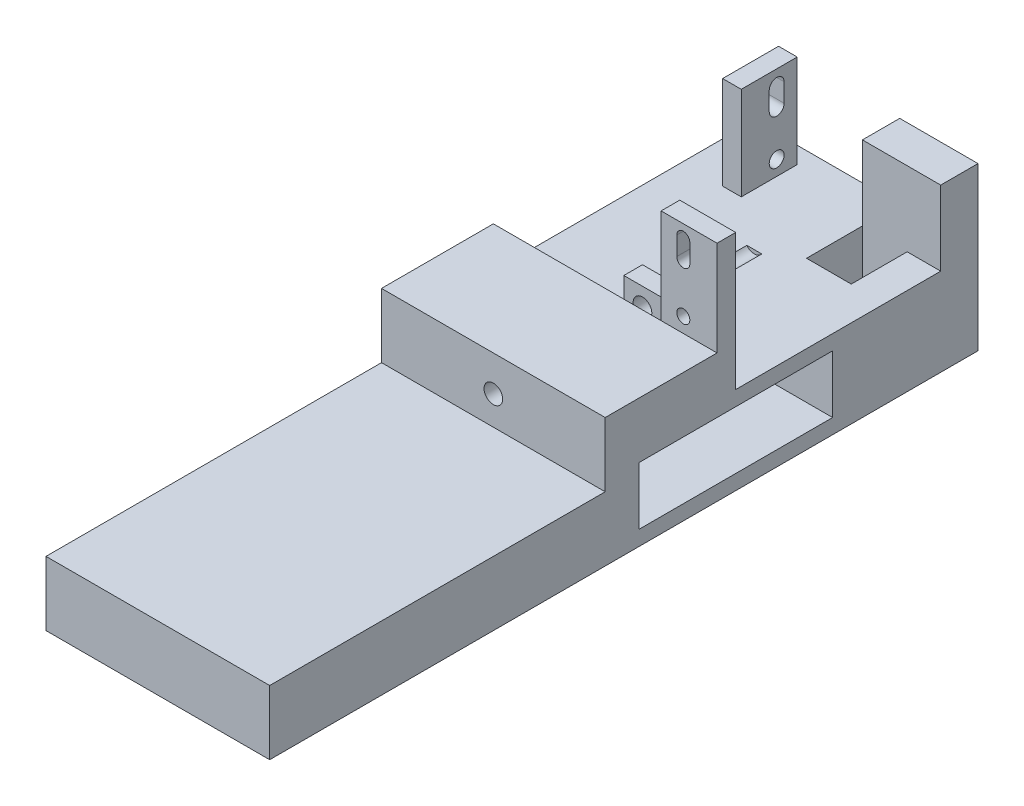
from build123d import *

# Parameters (mm, degrees)
SKETCH1_W               = 60
SKETCH1_H               = 70
BOSS_EXTRUDE1_DEPTH     = 23.5
SHELL1_T                = -9
SKETCH2_W               = 10
SKETCH2_H               = 5
BOSS_EXTRUDE2_DEPTH     = 6.5
SKETCH5_W               = 60
SKETCH5_H               = 30
BOSS_EXTRUDE3_DEPTH     = 11
CUT_EXTRUDE1_DEPTH      = 83.554527435
CUT_EXTRUDE1_DEPTH_BACK = 83.554527435
SKETCH3_R               = 2.5
SKETCH4_W               = 30
SKETCH4_H               = 10
CUT_EXTRUDE2_DEPTH      = 10
SKETCH6_W               = 15
SKETCH6_H               = 5
BOSS_EXTRUDE4_DEPTH     = 36.5
SKETCH8_R               = 1.75
CUT_EXTRUDE3_DEPTH      = 10
SKETCH9_W               = 60
SKETCH9_H               = 23.5
BOSS_EXTRUDE5_DEPTH     = 30
CUT_EXTRUDE4_DEPTH      = 123.197585901
CUT_EXTRUDE4_DEPTH_BACK = 123.197585901
SKETCH11_W              = 12
SKETCH11_H              = 15
SKETCH12_W              = 5
SKETCH12_H              = 15
BOSS_EXTRUDE7_DEPTH     = 25
SKETCH13_R              = 2
CUT_EXTRUDE5_DEPTH      = 25
SKETCH14_W              = 21
SKETCH14_H              = 10
BOSS_EXTRUDE8_DEPTH     = 20
SKETCH15_W              = 60
SKETCH15_H              = 17.25
BOSS_EXTRUDE9_DEPTH     = 90
CUT_EXTRUDE6_DEPTH      = 132.148770486
CUT_EXTRUDE6_DEPTH_BACK = 132.148770486
SKETCH16_W              = 52
SKETCH16_H              = 15.5


with BuildPart() as part:
    # Sketch1 → Boss-Extrude1 (new body)
    with BuildSketch(Plane(origin=(0, 0, 0), x_dir=(1, 0, 0), z_dir=(0, 1, 0))):
        with Locations((-30, 35)):
            Rectangle(SKETCH1_W, SKETCH1_H)
    extrude(amount=BOSS_EXTRUDE1_DEPTH)

    # Shell1
    shell1_openings = [part.faces().sort_by_distance(p)[0] for p in [
        (-60, 11.75, -35),
        (0, 11.75, -35),
    ]]
    offset(amount=SHELL1_T, openings=shell1_openings, kind=Kind.INTERSECTION)

    # Sketch2 → Boss-Extrude2 (add)
    with BuildSketch(Plane(origin=(0, 23.5, 0), x_dir=(1, 0, 0), z_dir=(0, 1, 0))):
        with Locations((-30, 42.5)):
            Rectangle(SKETCH2_W, SKETCH2_H)
        with Locations((-30, 27.5)):
            Rectangle(SKETCH2_W, SKETCH2_H)
    extrude(amount=BOSS_EXTRUDE2_DEPTH)

    # Sketch5 → Boss-Extrude3 (add)
    with BuildSketch(Plane(origin=(0, 23.5, 0), x_dir=(1, 0, 0), z_dir=(0, 1, 0))):
        with Locations((-30, 15)):
            Rectangle(SKETCH5_W, SKETCH5_H)
    extrude(amount=BOSS_EXTRUDE3_DEPTH)

    # Sketch3 → Cut-Extrude1 (cut, two sides: drawn at the far end of the back side and taken through both)
    with BuildSketch(Plane(origin=(0, 0, -45), x_dir=(-1, 0, 0), z_dir=(0, 0, -1)).offset(-CUT_EXTRUDE1_DEPTH_BACK)):
        with Locations((30, 25)):
            Circle(SKETCH3_R)
    extrude(amount=CUT_EXTRUDE1_DEPTH + CUT_EXTRUDE1_DEPTH_BACK, mode=Mode.SUBTRACT)

    # Sketch4 → Cut-Extrude2 (cut)
    with BuildSketch(Plane(origin=(0, 23.5, 0), x_dir=(1, 0, 0), z_dir=(0, 1, 0))):
        with Locations((-30, 35)):
            Rectangle(SKETCH4_W, SKETCH4_H)
    extrude(amount=-CUT_EXTRUDE2_DEPTH, mode=Mode.SUBTRACT)

    # Sketch6 → Boss-Extrude4 (add)
    with BuildSketch(Plane(origin=(0, 23.5, 0), x_dir=(1, 0, 0), z_dir=(0, 1, 0))):
        with Locations((-7.5, 32.5)):
            Rectangle(SKETCH6_W, SKETCH6_H)
    extrude(amount=BOSS_EXTRUDE4_DEPTH)

    # Sketch8 → Cut-Extrude3 (cut)
    with BuildSketch(Plane(origin=(0, 0, -35), x_dir=(-1, 0, 0), z_dir=(0, 0, -1))):
        with Locations((9.05, 38.5)):
            Circle(SKETCH8_R)
        with BuildLine():
            Line((7.3, 56.5), (7.3, 51.5))
            ThreePointArc((7.3, 51.5), (9.05, 49.75), (10.8, 51.5))
            Line((10.8, 51.5), (10.8, 56.5))
            ThreePointArc((10.8, 56.5), (9.05, 58.25), (7.3, 56.5))
        make_face()
    extrude(amount=-CUT_EXTRUDE3_DEPTH, mode=Mode.SUBTRACT)

    # Sketch9 → Boss-Extrude5 (add)
    with BuildSketch(Plane(origin=(0, 0, -70), x_dir=(-1, 0, 0), z_dir=(0, 0, -1))):
        with Locations((30, 11.75)):
            Rectangle(SKETCH9_W, SKETCH9_H)
    extrude(amount=BOSS_EXTRUDE5_DEPTH)

    # Sketch11 → Cut-Extrude4 (cut, two sides: drawn at the far end of the back side and taken through both)
    with BuildSketch(Plane(origin=(0, 23.5, 0), x_dir=(1, 0, 0), z_dir=(0, 1, 0)).offset(-CUT_EXTRUDE4_DEPTH_BACK)):
        with Locations((-15, 82.5)):
            Rectangle(SKETCH11_W, SKETCH11_H)
    extrude(amount=CUT_EXTRUDE4_DEPTH + CUT_EXTRUDE4_DEPTH_BACK, mode=Mode.SUBTRACT)

    # Sketch12 → Boss-Extrude7 (add)
    with BuildSketch(Plane(origin=(0, 23.5, 0), x_dir=(1, 0, 0), z_dir=(0, 1, 0))):
        with Locations((-46.5, 88)):
            Rectangle(SKETCH12_W, SKETCH12_H)
    extrude(amount=BOSS_EXTRUDE7_DEPTH)

    # Sketch13 → Cut-Extrude5 (cut)
    with BuildSketch(Plane.ZY.offset(49)):
        with Locations((-90, 27.5)):
            Circle(SKETCH13_R)
        with BuildLine():
            Line((-88, 44.5), (-88, 39.5))
            ThreePointArc((-88, 39.5), (-90, 37.5), (-92, 39.5))
            Line((-92, 39.5), (-92, 44.5))
            ThreePointArc((-92, 44.5), (-90, 46.5), (-88, 44.5))
        make_face()
    extrude(amount=-CUT_EXTRUDE5_DEPTH, mode=Mode.SUBTRACT)

    # Sketch14 → Boss-Extrude8 (add)
    with BuildSketch(Plane(origin=(0, 23.5, 0), x_dir=(1, 0, 0), z_dir=(0, 1, 0))):
        with Locations((-10.5, 95)):
            Rectangle(SKETCH14_W, SKETCH14_H)
    extrude(amount=BOSS_EXTRUDE8_DEPTH)

    # Sketch15 → Boss-Extrude9 (add)
    with BuildSketch(Plane.XY):
        with Locations((-30, 8.625)):
            Rectangle(SKETCH15_W, SKETCH15_H)
    extrude(amount=BOSS_EXTRUDE9_DEPTH)

    # Sketch16 → Cut-Extrude6 (cut, two sides: drawn at the far end of the back side and taken through both)
    with BuildSketch(Plane(origin=(0, 0, 0), x_dir=(0, 0, -1), z_dir=(1, 0, 0)).offset(-CUT_EXTRUDE6_DEPTH_BACK)):
        with Locations((35, 11.75)):
            Rectangle(SKETCH16_W, SKETCH16_H)
    extrude(amount=CUT_EXTRUDE6_DEPTH + CUT_EXTRUDE6_DEPTH_BACK, mode=Mode.SUBTRACT)


solid = part.part
